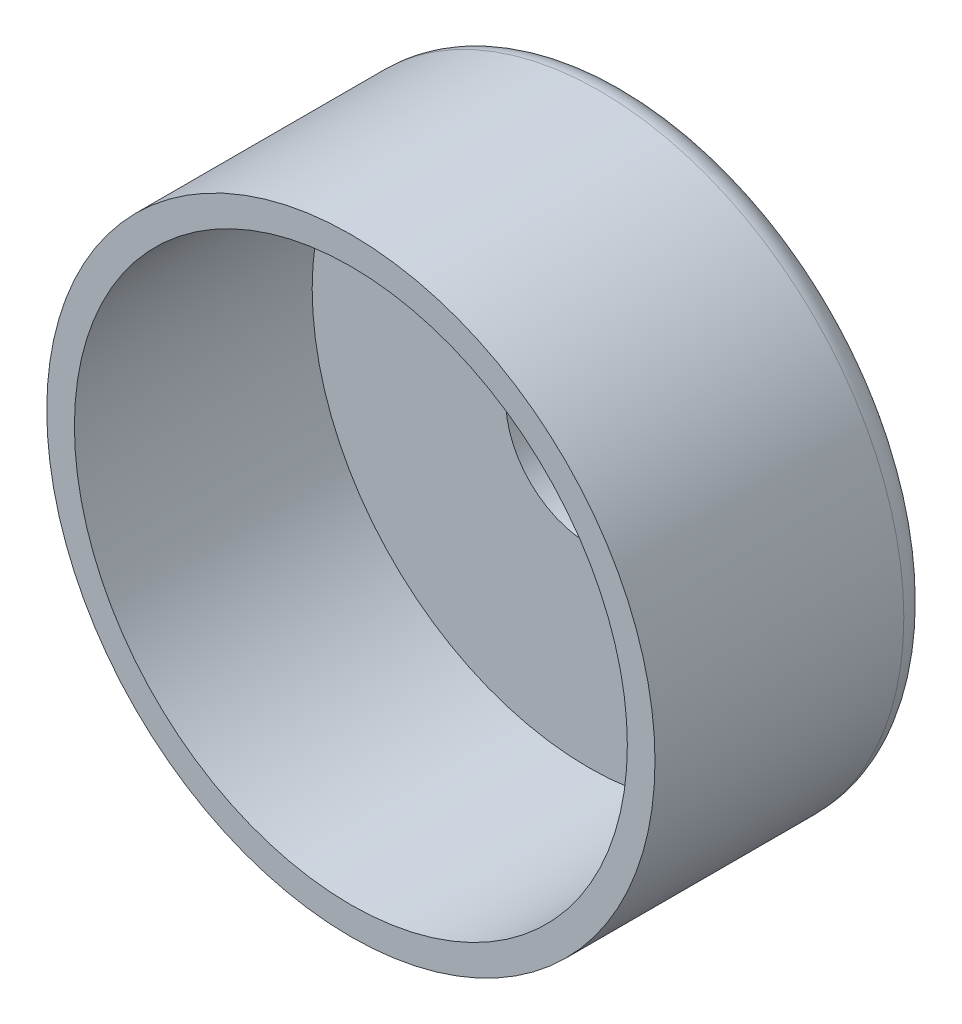
from build123d import *

# Parameters (mm, degrees)
SKETCH1_R           = 100
SKETCH1_R_2         = 6.9
SKETCH1_R_3         = 10.75
SKETCH1_R_4         = 3
SKETCH1_R_5         = 2.25
SKETCH1_R_6         = 7
BOSS_EXTRUDE1_DEPTH = 6
SKETCH1_3_R         = 110
SKETCH1_3_R_2       = 100
BOSS_EXTRUDE2_DEPTH = 100
FILLET1_R           = 10
SKETCH1_11_R        = 100
SKETCH1_11_R_2      = 6.9
SKETCH1_11_R_3      = 7
SKETCH1_11_R_4      = 2.25
SKETCH1_11_R_5      = 6.7
SKETCH1_11_R_6      = 14
BOSS_EXTRUDE7_DEPTH = 14
SKETCH7_R           = 30
CUT_EXTRUDE3_DEPTH  = 110


with BuildPart() as part:
    # Sketch1 → Boss-Extrude1 (new body)
    with BuildSketch(Plane.XY):
        Circle(SKETCH1_R)
        with Locations((30.882391056, 73.798901907)):
            Circle(SKETCH1_R_2, mode=Mode.SUBTRACT)
        with Locations((0, 80)):
            Circle(SKETCH1_R_3, mode=Mode.SUBTRACT)
        with Locations((-31.073387423, 73.718685515)):
            Circle(SKETCH1_R_4, mode=Mode.SUBTRACT)
        with Locations((-49.00574775, 63.233192925)):
            Circle(SKETCH1_R_5, mode=Mode.SUBTRACT)
        with Locations((51.329760909, 61.361678962)):
            Circle(SKETCH1_R_6, mode=Mode.SUBTRACT)
    extrude(amount=BOSS_EXTRUDE1_DEPTH)

    # Sketch1<3> → Boss-Extrude2 (add)
    with BuildSketch(Plane.XY):
        Circle(SKETCH1_3_R)
        Circle(SKETCH1_3_R_2, mode=Mode.SUBTRACT)
    extrude(amount=BOSS_EXTRUDE2_DEPTH)

    # Fillet1
    fillet1_edges = [part.edges().sort_by_distance(p)[0] for p in [
        (-110, 0, 0),
    ]]
    fillet(fillet1_edges, radius=FILLET1_R)

    # Sketch1<11> → Boss-Extrude7 (add)
    with BuildSketch(Plane.XY):
        Circle(SKETCH1_11_R)
        with Locations((30.882391056, 73.798901907)):
            Circle(SKETCH1_11_R_2, mode=Mode.SUBTRACT)
        with Locations((51.329760909, 61.361678962)):
            Circle(SKETCH1_11_R_3, mode=Mode.SUBTRACT)
        with Locations((-49.00574775, 63.233192925)):
            Circle(SKETCH1_11_R_4, mode=Mode.SUBTRACT)
        with Locations((-31.073387423, 73.718685515)):
            Circle(SKETCH1_11_R_5, mode=Mode.SUBTRACT)
        with Locations((0, 80)):
            Circle(SKETCH1_11_R_6, mode=Mode.SUBTRACT)
    extrude(amount=BOSS_EXTRUDE7_DEPTH)

    # Sketch7 → Cut-Extrude3 (cut)
    with BuildSketch(Plane.XY.offset(14)):
        Circle(SKETCH7_R)
    extrude(amount=-CUT_EXTRUDE3_DEPTH, mode=Mode.SUBTRACT)


solid = part.part
